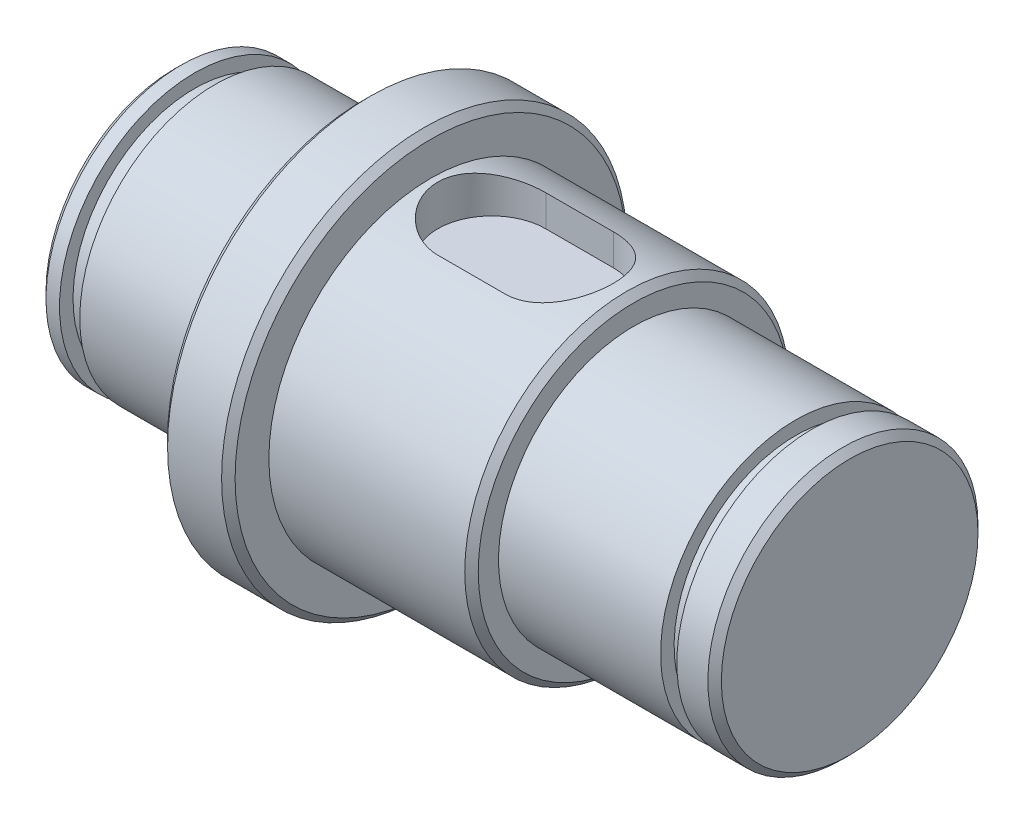
from build123d import *

# Parameters (mm, degrees)
SCHIZZO1_R                    = 10
ESTRUSIONE_ESTRUSIONE1_DEPTH  = 25
ESTRUSIONE_ESTRUSIONE2_START  = -16
SCHIZZO2_R                    = 12
SCHIZZO2_R_2                  = 10
ESTRUSIONE_ESTRUSIONE2_DEPTH  = 15
ESTRUSIONE_ESTRUSIONE3_START  = -19
SCHIZZO3_R                    = 15
SCHIZZO3_R_2                  = 10
ESTRUSIONE_ESTRUSIONE3_DEPTH  = 5
TAGLIO_ESTRUSIONE1_REACH      = 43.787
TAGLIO_ESTRUSIONE1_END_RADIUS = 12
TAGLIO_ESTRUSIONE1_START      = 9
SMUSSO1_SIZE                  = 0.5
SCHIZZO7_W                    = 1.2
SCHIZZO7_H                    = 1
SCHIZZO7_W_2                  = 1.5


with BuildPart() as part:
    # Schizzo1 → Estrusione-Estrusione1 (new, symmetric)
    with BuildSketch(Plane(origin=(0, 0, 0), x_dir=(0, 0, -1), z_dir=(1, 0, 0))):
        Circle(SCHIZZO1_R)
    extrude(amount=ESTRUSIONE_ESTRUSIONE1_DEPTH, both=True)

    # Schizzo2 → Estrusione-Estrusione2 (add)
    with BuildSketch(Plane(origin=(25, 0, 0), x_dir=(0, 0, -1), z_dir=(1, 0, 0)).offset(ESTRUSIONE_ESTRUSIONE2_START)):
        Circle(SCHIZZO2_R)
        Circle(SCHIZZO2_R_2, mode=Mode.SUBTRACT)
    extrude(amount=-ESTRUSIONE_ESTRUSIONE2_DEPTH)

    # Schizzo3 → Estrusione-Estrusione3 (add)
    with BuildSketch(Plane.ZY.offset(25).offset(ESTRUSIONE_ESTRUSIONE3_START)):
        Circle(SCHIZZO3_R)
        with Locations(Location((0, 0, 0), (0, 0, 180))):
            Circle(SCHIZZO3_R_2, mode=Mode.SUBTRACT)
    extrude(amount=ESTRUSIONE_ESTRUSIONE3_DEPTH)

    # Taglio-Estrusione1: up to this cylinder (the profile starts inside it)
    taglio_estrusione1_end = Plane(origin=(1, 0, 0), z_dir=(1, 0, 0)) * Cylinder(TAGLIO_ESTRUSIONE1_END_RADIUS, 112.574, mode=Mode.PRIVATE)
    # Schizzo5 → Taglio-Estrusione1 (cut, up to the surface)
    with BuildSketch(Plane(origin=(0, 0, 0), x_dir=(1, 0, 0), z_dir=(0, 1, 0)).offset(TAGLIO_ESTRUSIONE1_START), mode=Mode.PRIVATE) as taglio_estrusione1_sk1:
        with BuildLine():
            Line((-1.5, 4), (3.5, 4))
            ThreePointArc((3.5, 4), (7.5, 0), (3.5, -4))
            Line((3.5, -4), (-1.5, -4))
            ThreePointArc((-1.5, -4), (-5.5, 0), (-1.5, 4))
        make_face()
    taglio_estrusione1_tool1 = extrude(taglio_estrusione1_sk1.sketch, amount=TAGLIO_ESTRUSIONE1_REACH, mode=Mode.PRIVATE) & taglio_estrusione1_end
    add(taglio_estrusione1_tool1.solids().sort_by_distance((1, 9, 0))[0], mode=Mode.SUBTRACT)

    # Smusso1
    smusso1_edges = [part.edges().sort_by_distance(p)[0] for p in [
        (-6, 0, -15),
        (-11, 0, -15),
        (-25, 0, 10),
        (25, 0, 10),
        (9, 0, 12),
    ]]
    chamfer(smusso1_edges, length=SMUSSO1_SIZE)

    # Schizzo7 → Taglia-Rivoluzione1 (revolve, cut)
    with BuildSketch(Plane.XY, mode=Mode.PRIVATE) as taglia_rivoluzione1_sk:
        with Locations((21.6, 9.5)):
            Rectangle(SCHIZZO7_W, SCHIZZO7_H)
        with Locations((-22.75, 9.5)):
            Rectangle(SCHIZZO7_W_2, SCHIZZO7_H)
    revolve(taglia_rivoluzione1_sk.sketch.rotate(Axis((-25, 0, 0), (1, 0, 0)), 180), axis=Axis((-25, 0, 0), (1, 0, 0)), mode=Mode.SUBTRACT)


solid = part.part
